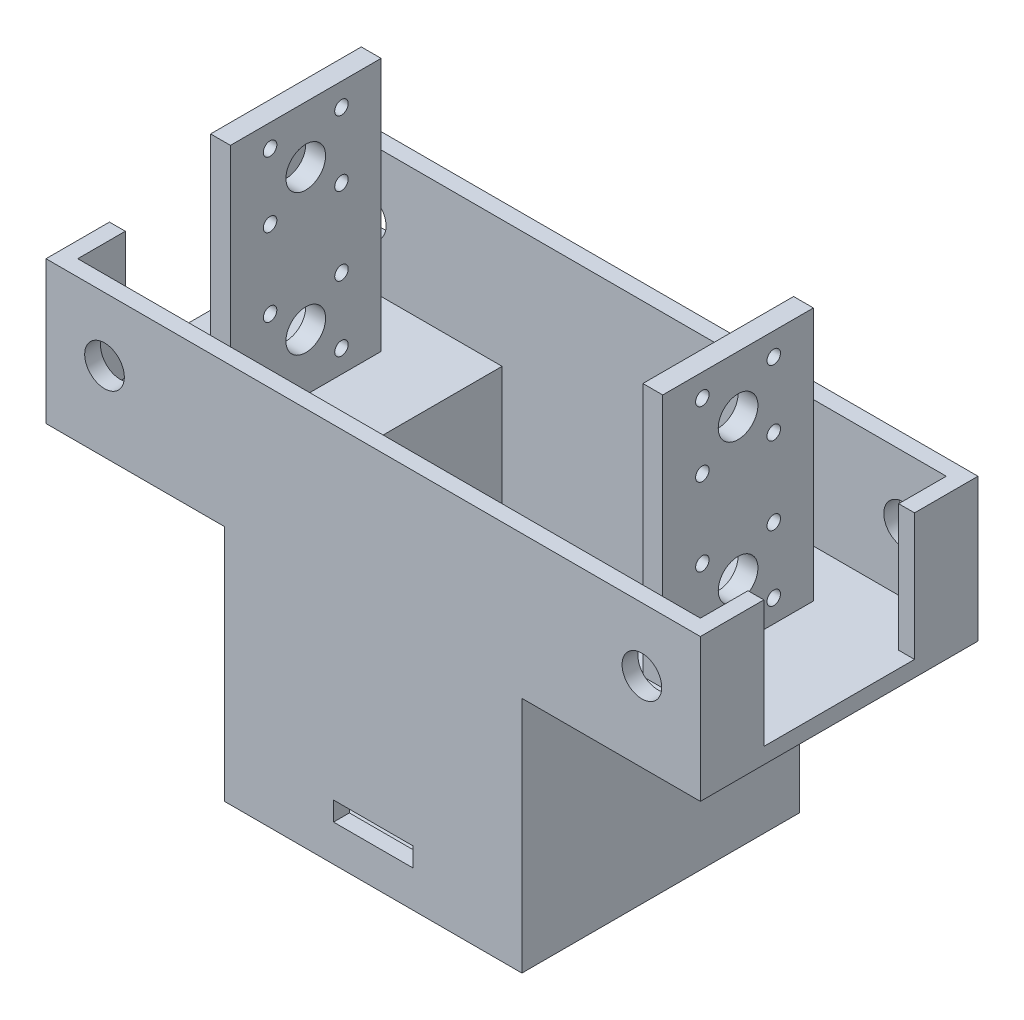
from build123d import *

# Parameters (mm, degrees)
SKETCH1_W                 = 75
SKETCH1_H                 = 40
SKETCH1_R                 = 5
SKETCH1_R_2               = 1.7
SKETCH1_R_3               = 1.197563381
SKETCH1_W_2               = 5
SKETCH1_H_2               = 20
BOSS_EXTRUDE1_DEPTH       = 3
CUT_EXTRUDE1_DEPTH        = 43.605750786
CUT_EXTRUDE1_DEPTH_BACK   = 43.605750786
SKETCH2_W                 = 67
SKETCH2_H                 = 28
BOSS_EXTRUDE3_DEPTH       = 90
BOSS_EXTRUDE3_DEPTH_BACK  = 3
SKETCH6_W                 = 67
SKETCH6_H                 = 11
CUT_EXTRUDE4_DEPTH        = 104.591746776
SKETCH7_W                 = 70
SKETCH7_H                 = 37
BOSS_EXTRUDE4_DEPTH       = 45
SKETCH8_W                 = 45
SKETCH8_H                 = 62
CUT_EXTRUDE6_DEPTH        = 29
SKETCH11_W                = 45
SKETCH11_H                = 4
CUT_EXTRUDE9_DEPTH        = 143.671826231
SKETCH9_W                 = 38
SKETCH9_H                 = 28.5
CUT_EXTRUDE10_DEPTH       = 193.611006954
SKETCH13_W                = 5
SKETCH13_H                = 38
BOSS_EXTRUDE5_DEPTH       = 32
SKETCH14_R                = 5
SKETCH14_R_2              = 1.7
CUT_EXTRUDE11_DEPTH       = 32
SKETCH15_W                = 165
SKETCH15_H                = 70
SKETCH15_W_2              = 157
SKETCH15_H_2              = 62
BOSS_EXTRUDE6_DEPTH       = 3
SKETCH16_W                = 20
SKETCH16_H                = 4.820648258
CUT_EXTRUDE12_DEPTH       = 145.645255712
SKETCH18_R                = 5
CUT_EXTRUDE14_DEPTH       = 145.645255712
MIRROR6_COPY_1_SKETCH_W   = 5
MIRROR6_COPY_1_SKETCH_H   = 38
MIRROR6_COPY_1_DEPTH      = 32
MIRROR6_COPY_2_SKETCH_R   = 5
MIRROR6_COPY_2_SKETCH_R_2 = 1.7
MIRROR6_COPY_2_DEPTH      = 32
SKETCH19_W                = 38
SKETCH19_H                = 3.5
CUT_EXTRUDE15_DEPTH       = 10


with BuildPart() as part:
    # Sketch1 → Boss-Extrude1 (new body)
    with BuildSketch(Plane(origin=(0, 0, 0), x_dir=(1, 0, 0), z_dir=(0, 1, 0))):
        Rectangle(SKETCH1_W, SKETCH1_H)
        with Locations(Location((-21, 0, 0), (0, 0, 270))):
            Circle(SKETCH1_R, mode=Mode.SUBTRACT)
        with Locations(Location((-30, 8.25, 0), (0, 0, 270))):
            Circle(SKETCH1_R_2, mode=Mode.SUBTRACT)
        with Locations(Location((-12, 8.25, 0), (0, 0, 270))):
            Circle(SKETCH1_R_2, mode=Mode.SUBTRACT)
        with Locations(Location((-12, -8.25, 0), (0, 0, 270))):
            Circle(SKETCH1_R_2, mode=Mode.SUBTRACT)
        with Locations(Location((-30, -8.25, 0), (0, 0, 270))):
            Circle(SKETCH1_R_2, mode=Mode.SUBTRACT)
        with Locations(Location((12, 8.25, 0), (0, 0, 90))):
            Circle(SKETCH1_R_2, mode=Mode.SUBTRACT)
        with Locations(Location((12, -8.25, 0), (0, 0, 90))):
            Circle(SKETCH1_R_2, mode=Mode.SUBTRACT)
        with Locations(Location((21, 0, 0), (0, 0, 90))):
            Circle(SKETCH1_R, mode=Mode.SUBTRACT)
        with Locations(Location((30, -8.25, 0), (0, 0, 90))):
            Circle(SKETCH1_R_2, mode=Mode.SUBTRACT)
        with Locations(Location((30, 8.25, 0), (0, 0, 90))):
            Circle(SKETCH1_R_2, mode=Mode.SUBTRACT)
        with Locations(Location((-30, -17.5, 0), (0, 0, 270))):
            Circle(SKETCH1_R_3, mode=Mode.SUBTRACT)
        with Locations(Location((-12, -17.5, 0), (0, 0, 270))):
            Circle(SKETCH1_R_3, mode=Mode.SUBTRACT)
        with Locations(Location((12, -17.5, 0), (0, 0, 90))):
            Circle(SKETCH1_R_3, mode=Mode.SUBTRACT)
        with Locations(Location((30, -17.5, 0), (0, 0, 90))):
            Circle(SKETCH1_R_3, mode=Mode.SUBTRACT)
        with Locations(Location((30, 17.5, 0), (0, 0, 270))):
            Circle(SKETCH1_R_3, mode=Mode.SUBTRACT)
        with Locations(Location((12, 17.5, 0), (0, 0, 270))):
            Circle(SKETCH1_R_3, mode=Mode.SUBTRACT)
        with Locations(Location((-12, 17.5, 0), (0, 0, 90))):
            Circle(SKETCH1_R_3, mode=Mode.SUBTRACT)
        with Locations(Location((-30, 17.5, 0), (0, 0, 90))):
            Circle(SKETCH1_R_3, mode=Mode.SUBTRACT)
        Rectangle(SKETCH1_W_2, SKETCH1_H_2, mode=Mode.SUBTRACT)
    extrude(amount=BOSS_EXTRUDE1_DEPTH)

    # Sketch2 → Cut-Extrude1 (cut, two sides: drawn at the far end of the back side and taken through both)
    with BuildSketch(Plane(origin=(0, 3, 0), x_dir=(1, 0, 0), z_dir=(0, 1, 0)).offset(-CUT_EXTRUDE1_DEPTH_BACK)):
        Rectangle(SKETCH2_W, SKETCH2_H)
    extrude(amount=CUT_EXTRUDE1_DEPTH + CUT_EXTRUDE1_DEPTH_BACK, mode=Mode.SUBTRACT)

    # Sketch3 → Boss-Extrude3 (add, two sides: drawn at the far end of the back side and taken through both)
    with BuildSketch(Plane(origin=(0, 3, 0), x_dir=(1, 0, 0), z_dir=(0, 1, 0)).offset(-BOSS_EXTRUDE3_DEPTH_BACK)):
        Polygon((37.5, -35), (37.5, -20), (33.5, -20), (-33.5, -20), (-37.5, -20), (-37.5, -35), align=None)
        Polygon((33.5, 20), (37.5, 20), (37.5, 35), (-37.5, 35), (-37.5, 20), (-33.5, 20), align=None)
        Polygon((37.5, -20), (37.5, 20), (33.5, 20), (33.5, 14), (33.5, -14), (33.5, -20), align=None)
        Polygon((-33.5, 14), (-33.5, 20), (-37.5, 20), (-37.5, -20), (-33.5, -20), (-33.5, -14), align=None)
    extrude(amount=BOSS_EXTRUDE3_DEPTH + BOSS_EXTRUDE3_DEPTH_BACK)

    # Sketch6 → Cut-Extrude4 (cut, through all)
    with BuildSketch(Plane(origin=(0, 3, 0), x_dir=(1, 0, 0), z_dir=(0, 1, 0))):
        with Locations((0, -25.5)):
            Rectangle(SKETCH6_W, SKETCH6_H)
        with Locations((0, 25.5)):
            Rectangle(SKETCH6_W, SKETCH6_H)
    extrude(amount=CUT_EXTRUDE4_DEPTH, mode=Mode.SUBTRACT)

    # Sketch7 → Boss-Extrude4 (add)
    with BuildSketch(Plane.ZY.offset(37.5)):
        with Locations((0, 74.5)):
            Rectangle(SKETCH7_W, SKETCH7_H)
    boss_extrude4 = extrude(amount=BOSS_EXTRUDE4_DEPTH)

    # Mirror2: Boss-Extrude4 across plane
    add(boss_extrude4.mirror(Plane(origin=(0, 0, 0), x_dir=(0, 0, 1), z_dir=(1, 0, 0))))

    # Sketch8 → Cut-Extrude6 (cut)
    with BuildSketch(Plane(origin=(0, 93, 0), x_dir=(1, 0, 0), z_dir=(0, 1, 0))):
        with Locations((-56, 0)):
            Rectangle(SKETCH8_W, SKETCH8_H)
        with Locations((56, 0)):
            Rectangle(SKETCH8_W, SKETCH8_H)
    extrude(amount=-CUT_EXTRUDE6_DEPTH, mode=Mode.SUBTRACT)

    # Sketch11 → Cut-Extrude9 (cut, through all)
    with BuildSketch(Plane.XY.offset(35)):
        with Locations((-60, 58)):
            Rectangle(SKETCH11_W, SKETCH11_H)
        with Locations((60, 58)):
            Rectangle(SKETCH11_W, SKETCH11_H)
    extrude(amount=-CUT_EXTRUDE9_DEPTH, mode=Mode.SUBTRACT)

    # Sketch9 → Cut-Extrude10 (cut, through all)
    with BuildSketch(Plane.ZY.offset(82.5)):
        with Locations((0, 78.25)):
            Rectangle(SKETCH9_W, SKETCH9_H)
    extrude(amount=-CUT_EXTRUDE10_DEPTH, mode=Mode.SUBTRACT)

    # Sketch13 → Boss-Extrude5 (add)
    with BuildSketch(Plane(origin=(0, 64, 0), x_dir=(1, 0, 0), z_dir=(0, 1, 0))):
        with Locations((-54.5, 0)):
            Rectangle(SKETCH13_W, SKETCH13_H)
    boss_extrude5 = extrude(amount=BOSS_EXTRUDE5_DEPTH)

    # Sketch14 → Cut-Extrude11 (cut)
    with BuildSketch(Plane.ZY.offset(57)):
        with Locations((0, 78.25)):
            Circle(SKETCH14_R)
        with Locations((-9, 86.202083543)):
            Circle(SKETCH14_R_2)
        with Locations((9, 86.202083543)):
            Circle(SKETCH14_R_2)
        with Locations((9, 69.702083543)):
            Circle(SKETCH14_R_2)
        with Locations((-9, 69.702083543)):
            Circle(SKETCH14_R_2)
    cut_extrude11 = extrude(amount=-CUT_EXTRUDE11_DEPTH, mode=Mode.SUBTRACT)

    # Mirror4: Boss-Extrude5, Cut-Extrude11 across plane
    add(boss_extrude5.mirror(Plane(origin=(0, 0, 0), x_dir=(0, 0, 1), z_dir=(1, 0, 0))))
    add(cut_extrude11.mirror(Plane(origin=(0, 0, 0), x_dir=(0, 0, 1), z_dir=(1, 0, 0))), mode=Mode.SUBTRACT)

    # Sketch15 → Boss-Extrude6 (add)
    with BuildSketch(Plane(origin=(0, 93, 0), x_dir=(1, 0, 0), z_dir=(0, 1, 0))):
        Rectangle(SKETCH15_W, SKETCH15_H)
        Rectangle(SKETCH15_W_2, SKETCH15_H_2, mode=Mode.SUBTRACT)
    extrude(amount=BOSS_EXTRUDE6_DEPTH)

    # Sketch16 → Cut-Extrude12 (cut, through all)
    with BuildSketch(Plane.XY.offset(35)):
        with Locations((0, 11.636111214)):
            Rectangle(SKETCH16_W, SKETCH16_H)
    extrude(amount=-CUT_EXTRUDE12_DEPTH, mode=Mode.SUBTRACT)

    # Sketch18 → Cut-Extrude14 (cut, through all)
    with BuildSketch(Plane.XY.offset(35)):
        with Locations((67.75, 80)):
            Circle(SKETCH18_R)
    cut_extrude14 = extrude(amount=-CUT_EXTRUDE14_DEPTH, mode=Mode.SUBTRACT)

    # Mirror5: Cut-Extrude14 across plane
    add(cut_extrude14.mirror(Plane(origin=(0, 0, 0), x_dir=(0, 0, 1), z_dir=(1, 0, 0))), mode=Mode.SUBTRACT)

    # Mirror6: Boss-Extrude5, Cut-Extrude11 across plane
    add(boss_extrude5.mirror(Plane.ZX.offset(96)))
    add(cut_extrude11.mirror(Plane.ZX.offset(96)), mode=Mode.SUBTRACT)

    # Mirror6 copy 1 sketch → Mirror6 copy 1 (add)
    with BuildSketch(Plane(origin=(0, 128, 0), x_dir=(-1, 0, 0), z_dir=(0, -1, 0))):
        with Locations((-54.5, 0)):
            Rectangle(MIRROR6_COPY_1_SKETCH_W, MIRROR6_COPY_1_SKETCH_H)
    extrude(amount=MIRROR6_COPY_1_DEPTH)

    # Mirror6 copy 2 sketch → Mirror6 copy 2 (cut)
    with BuildSketch(Plane(origin=(57, 192, 0), x_dir=(0, 0, 1), z_dir=(1, 0, 0))):
        with Locations((0, 78.25)):
            Circle(MIRROR6_COPY_2_SKETCH_R)
        with Locations((-9, 86.202083543)):
            Circle(MIRROR6_COPY_2_SKETCH_R_2)
        with Locations((9, 86.202083543)):
            Circle(MIRROR6_COPY_2_SKETCH_R_2)
        with Locations((9, 69.702083543)):
            Circle(MIRROR6_COPY_2_SKETCH_R_2)
        with Locations((-9, 69.702083543)):
            Circle(MIRROR6_COPY_2_SKETCH_R_2)
    extrude(amount=-MIRROR6_COPY_2_DEPTH, mode=Mode.SUBTRACT)

    # Sketch19 → Cut-Extrude15 (cut)
    with BuildSketch(Plane(origin=(82.5, 0, 0), x_dir=(0, 0, -1), z_dir=(1, 0, 0))):
        with Locations((0, 94.25)):
            Rectangle(SKETCH19_W, SKETCH19_H)
    cut_extrude15 = extrude(amount=-CUT_EXTRUDE15_DEPTH, mode=Mode.SUBTRACT)

    # Mirror7: Cut-Extrude15 across plane
    add(cut_extrude15.mirror(Plane(origin=(0, 0, 0), x_dir=(0, 0, 1), z_dir=(1, 0, 0))), mode=Mode.SUBTRACT)


solid = part.part
